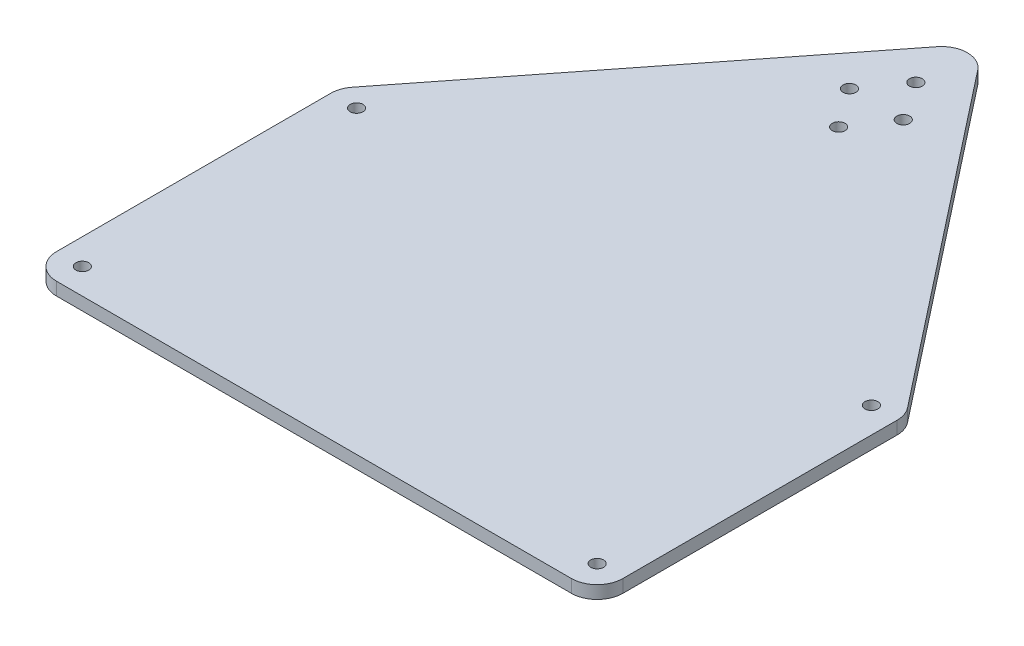
from build123d import *

# Parameters (mm, degrees)
SKETCH1_R           = 3.175
BOSS_EXTRUDE2_DEPTH = 6.35


with BuildPart() as part:
    # Sketch1 → Boss-Extrude2 (new body)
    with BuildSketch(Plane(origin=(0, 0, 0), x_dir=(1, 0, 0), z_dir=(0, 1, 0))):
        with BuildLine():
            Line((-125.579322034, 0), (128.420677966, 0))
            ThreePointArc((128.420677966, 0), (137.400934087, 3.719743879), (141.120677966, 12.7))
            Line((141.120677966, 12.7), (141.120677966, 148.007538959))
            ThreePointArc((141.120677966, 148.007538959), (140.423079494, 152.158726448), (138.406920869, 155.853872669))
            Line((138.406920869, 155.853872669), (11.406920869, 317.490236305))
            ThreePointArc((11.406920869, 317.490236305), (1.420677966, 322.343902596), (-8.565564937, 317.490236305))
            Line((-8.565564937, 317.490236305), (-135.565564937, 155.853872669))
            ThreePointArc((-135.565564937, 155.853872669), (-137.581723562, 152.158726448), (-138.279322034, 148.007538959))
            Line((-138.279322034, 148.007538959), (-138.279322034, 12.7))
            ThreePointArc((-138.279322034, 12.7), (-134.559578155, 3.719743879), (-125.579322034, 0))
        make_face()
        with Locations(Location((1.420677966, 296.943902596, 0), (0, 0, 270))):
            Circle(SKETCH1_R, mode=Mode.SUBTRACT)
        with Locations(Location((-12.295062697, 277.893902596, 0), (0, 0, 270))):
            Circle(SKETCH1_R, mode=Mode.SUBTRACT)
        with Locations(Location((14.258408226, 277.893902596, 0), (0, 0, 270))):
            Circle(SKETCH1_R, mode=Mode.SUBTRACT)
        with Locations(Location((1.420677966, 258.843902596, 0), (0, 0, 270))):
            Circle(SKETCH1_R, mode=Mode.SUBTRACT)
        with Locations(Location((-125.579322034, 148.007538959, 0), (0, 0, 270))):
            Circle(SKETCH1_R, mode=Mode.SUBTRACT)
        with Locations(Location((128.420677966, 148.007538959, 0), (0, 0, 270))):
            Circle(SKETCH1_R, mode=Mode.SUBTRACT)
        with Locations(Location((128.420677966, 12.7, 0), (0, 0, 270))):
            Circle(SKETCH1_R, mode=Mode.SUBTRACT)
        with Locations(Location((-125.579322034, 12.7, 0), (0, 0, 270))):
            Circle(SKETCH1_R, mode=Mode.SUBTRACT)
    extrude(amount=BOSS_EXTRUDE2_DEPTH)


solid = part.part
